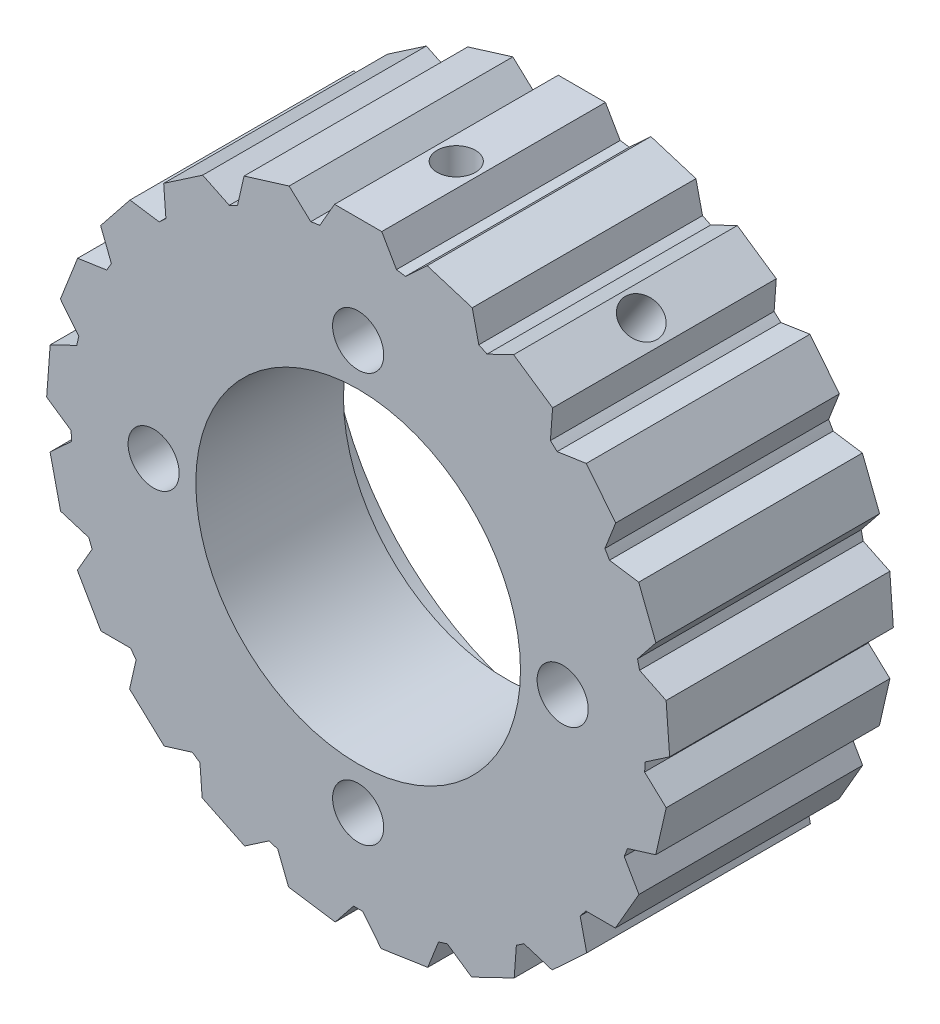
from build123d import *

# Parameters (mm, degrees)
SKETCH1_R           = 12.7
BOSS_EXTRUDE1_DEPTH = 17.5
SKETCH2_R           = 1.75
CUT_EXTRUDE1_DEPTH  = 10
CIRPATTERN1_COUNT   = 4
CIRPATTERN7_COUNT   = 21
SKETCH5_R           = 19.84375
CUT_EXTRUDE5_DEPTH  = 5.95
SKETCH9_R           = 2
CUT_EXTRUDE11_DEPTH = 26
CIRPATTERN9_COUNT   = 4
SKETCH10_R          = 1.5
CUT_EXTRUDE12_DEPTH = 26
SKETCH11_R          = 1.5
CUT_EXTRUDE13_DEPTH = 30


with BuildPart() as part:
    # Sketch1 → Boss-Extrude1 (new body)
    with BuildSketch(Plane.XY):
        with BuildLine():
            Line((-1.845299462, 24.299103121), (-3, 22.299103121))
            ThreePointArc((-3, 22.299103121), (0, -22.5), (3, 22.299103121))
            Line((3, 22.299103121), (1.845299462, 24.299103121))
            Line((1.845299462, 24.299103121), (-1.845299462, 24.299103121))
        make_face()
        Circle(SKETCH1_R, mode=Mode.SUBTRACT)
    boss_extrude1 = extrude(amount=BOSS_EXTRUDE1_DEPTH)

    # Sketch2 → Cut-Extrude1 (cut)
    with BuildSketch(Plane.XY.offset(17.5)):
        with Locations((-11.6, 11.6)):
            Circle(SKETCH2_R)
    cut_extrude1 = extrude(amount=-CUT_EXTRUDE1_DEPTH, mode=Mode.SUBTRACT)

    # CirPattern1: Cut-Extrude1 ×4 about axis
    cirpattern1_axis = Axis((0, 0, 0), (0, 0, 1))
    for i in range(1, CIRPATTERN1_COUNT):
        add(cut_extrude1.rotate(cirpattern1_axis, i * 360 / CIRPATTERN1_COUNT), mode=Mode.SUBTRACT)

    # CirPattern7: Boss-Extrude1 ×21 about axis
    cirpattern7_axis = Axis((0, 0, 0), (0, 0, 1))
    for i in range(1, CIRPATTERN7_COUNT):
        add(boss_extrude1.rotate(cirpattern7_axis, i * 360 / CIRPATTERN7_COUNT))

    # Sketch5 → Cut-Extrude5 (cut)
    with BuildSketch(Plane(origin=(0, 0, 0), x_dir=(-1, 0, 0), z_dir=(0, 0, -1))):
        Circle(SKETCH5_R)
    extrude(amount=-CUT_EXTRUDE5_DEPTH, mode=Mode.SUBTRACT)

    # Sketch9 → Cut-Extrude11 (cut)
    with BuildSketch(Plane(origin=(0, 0, 5.95), x_dir=(-1, 0, 0), z_dir=(0, 0, -1))):
        with Locations((0, 16)):
            Circle(SKETCH9_R)
    cut_extrude11 = extrude(amount=-CUT_EXTRUDE11_DEPTH, mode=Mode.SUBTRACT)

    # CirPattern9: Cut-Extrude11 ×4 about axis
    cirpattern9_axis = Axis((0, 0, 0), (0, 0, 1))
    for i in range(1, CIRPATTERN9_COUNT):
        add(cut_extrude11.rotate(cirpattern9_axis, i * 360 / CIRPATTERN9_COUNT), mode=Mode.SUBTRACT)

    # Sketch10 → Cut-Extrude12 (cut)
    with BuildSketch(Plane(origin=(13.688172181, 20.07686118, 0), x_dir=(0.8262387743160019, -0.5633200580636119, 0), z_dir=(0.5633200580636117, 0.8262387743160018, 0))):
        with Locations(Location((-0.048095596, -8.999871489, 0), (0, 0, 180))):
            Circle(SKETCH10_R)
    extrude(amount=-CUT_EXTRUDE12_DEPTH, mode=Mode.SUBTRACT)

    # Sketch11 → Cut-Extrude13 (cut)
    with BuildSketch(Plane(origin=(0, 24.299103121, 0), x_dir=(1, 0, 0), z_dir=(0, 1, 0))):
        with Locations(Location((0, -9.826057875, 0), (0, 0, 270))):
            Circle(SKETCH11_R)
    extrude(amount=-CUT_EXTRUDE13_DEPTH, mode=Mode.SUBTRACT)


solid = part.part
